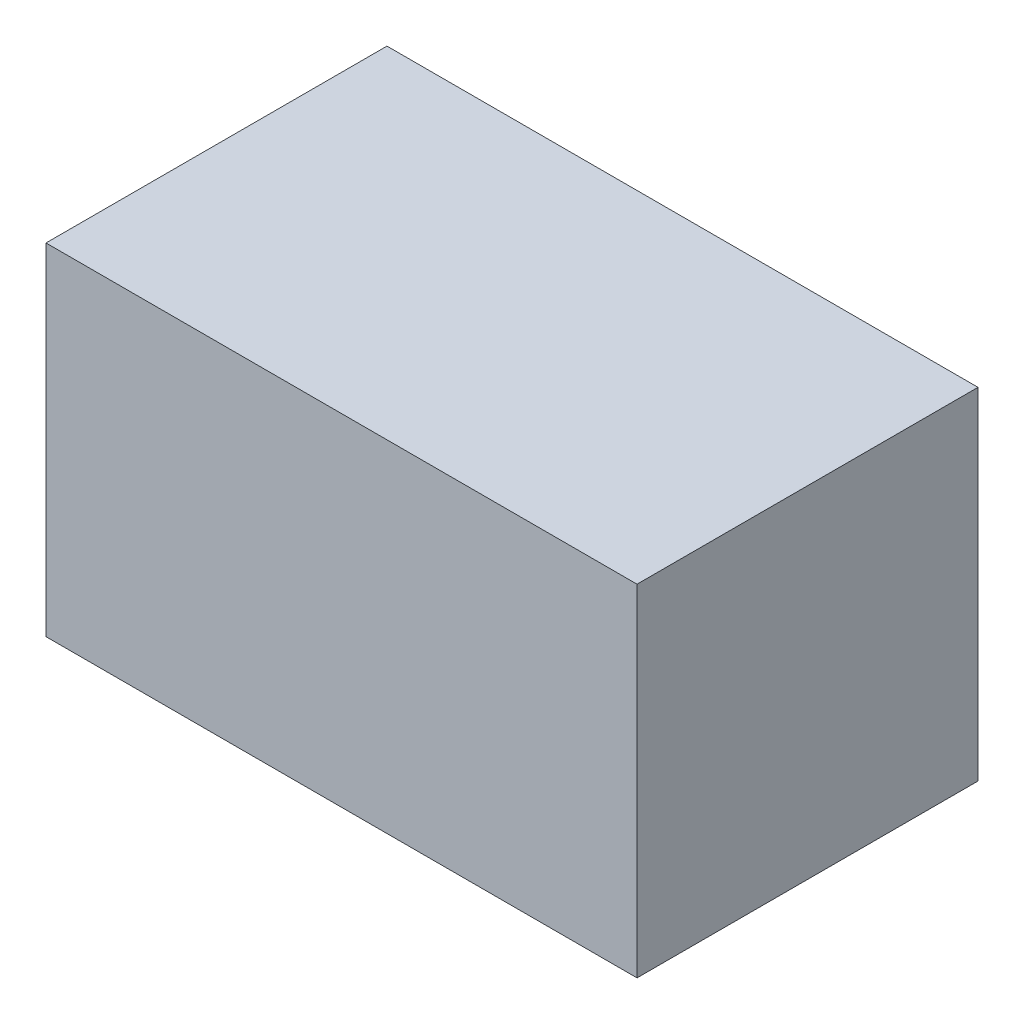
from build123d import *

# Parameters (mm, degrees)
SKETCH1_W           = 130
SKETCH1_H           = 75
BOSS_EXTRUDE1_DEPTH = 75


with BuildPart() as part:
    # Sketch1 → Boss-Extrude1 (new body)
    with BuildSketch(Plane.XY):
        with Locations((65, -37.5)):
            Rectangle(SKETCH1_W, SKETCH1_H)
    extrude(amount=BOSS_EXTRUDE1_DEPTH)


solid = part.part
